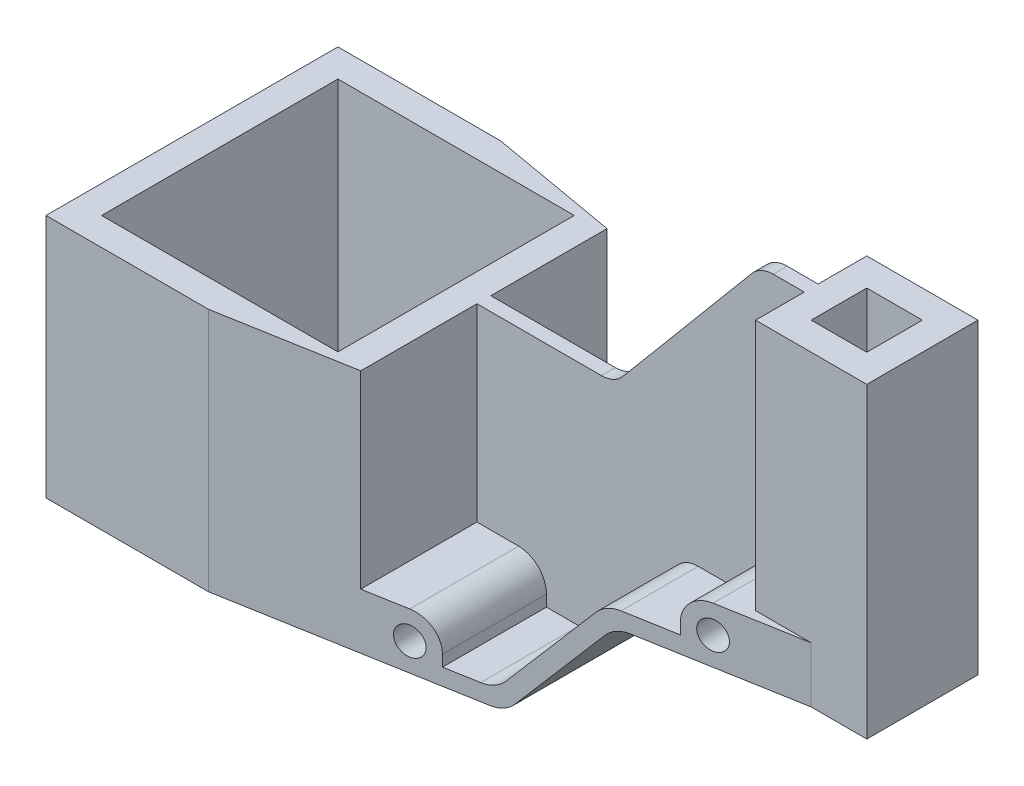
from build123d import *

# Parameters (mm, degrees)
ESQUISSE1_W                   = 105
ESQUISSE1_H                   = 105
ESQUISSE1_W_2                 = 85
ESQUISSE1_H_2                 = 85
BOSS_EXTRU_3_DEPTH            = 88
BOSS_EXTRU_4_DEPTH            = 105
ESQUISSE7_W                   = 40
ESQUISSE7_H                   = 40
ESQUISSE7_W_2                 = 20
ESQUISSE7_H_2                 = 20
BOSS_EXTRU_11_DEPTH           = 110.5
ENL_V_MAT_EXTRU_9_REACH       = 242.562
ESQUISSE13_W                  = 10
ESQUISSE13_H                  = 20
BOSS_EXTRU_12_DEPTH           = 2.5
ESQUISSE17_R                  = 5
ESQUISSE17_W                  = 40
ESQUISSE17_H                  = 20
BOSS_EXTRU_13_DEPTH           = 52.5
ENL_V_MAT_EXTRU_12_DEPTH      = 265.326910813
ENL_V_MAT_EXTRU_12_DEPTH_BACK = 265.326910813
ESQUISSE18_R                  = 5
ENL_V_MAT_EXTRU_13_REACH      = 236.819
ESQUISSE19_W                  = 10
ESQUISSE19_H                  = 20
CONG_1_R                      = 10
ENL_V_MAT_EXTRU_15_DEPTH      = 88


with BuildPart() as part:
    # Esquisse1 → Boss.-Extru.3 (new body)
    with BuildSketch(Plane(origin=(0, 0, 0), x_dir=(1, 0, 0), z_dir=(0, 1, 0))):
        Rectangle(ESQUISSE1_W, ESQUISSE1_H)
        Rectangle(ESQUISSE1_W_2, ESQUISSE1_H_2, mode=Mode.SUBTRACT)
    extrude(amount=BOSS_EXTRU_3_DEPTH)

    # Esquisse3 → Boss.-Extru.4 (add)
    with BuildSketch(Plane.XY.offset(52.5)):
        Polygon((52.5, 6), (52.5, 0), (96.658434537, 0), (130.222419784, 40), (190.222419784, 40), (190.222419784, 46), (127.424573836, 46), (93.860588588, 6), align=None)
    extrude(amount=-BOSS_EXTRU_4_DEPTH)

    # Esquisse7 → Boss.-Extru.11 (add)
    with BuildSketch(Plane.XZ.offset(-40)):
        with Locations((190.222419784, 0)):
            Rectangle(ESQUISSE7_W, ESQUISSE7_H)
        with Locations((190.222419784, 0)):
            Rectangle(ESQUISSE7_W_2, ESQUISSE7_H_2, mode=Mode.SUBTRACT)
    extrude(amount=-BOSS_EXTRU_11_DEPTH)

    # Esquisse13 → Enlèv. mat.-Extru.9 (cut, up to next)
    with BuildSketch(Plane(origin=(0, 46, 0), x_dir=(1, 0, 0), z_dir=(0, 1, 0)), mode=Mode.PRIVATE) as enl_v_mat_extru_9_sk1:
        with Locations((185.222419784, 0)):
            Rectangle(ESQUISSE13_W, ESQUISSE13_H)
    enl_v_mat_extru_9_tool1 = extrude(enl_v_mat_extru_9_sk1.sketch, amount=-ENL_V_MAT_EXTRU_9_REACH, mode=Mode.PRIVATE) & part.part
    add(enl_v_mat_extru_9_tool1.solids().sort_by_distance((185.22242, 46, 0))[0], mode=Mode.SUBTRACT)

    # Esquisse14 → Boss.-Extru.12 (add, symmetric)
    with BuildSketch(Plane.XY):
        Polygon((52.5, 88), (101.965319391, 88), (154.40904634, 150.5), (170.222419784, 150.5), (170.222419784, 46), (127.424573836, 46), (93.860588588, 6), (52.5, 6), align=None)
    extrude(amount=BOSS_EXTRU_12_DEPTH, both=True)

    # Esquisse17 → Boss.-Extru.13 (add, symmetric)
    # profile 1 of 2: a face of its own
    with BuildSketch(Plane.XY):
        Polygon((44, 20), (44, 0), (77.5, 0), (77.5, 6), (77.5, 20), align=None)
        with Locations((67.5, 10)):
            Circle(ESQUISSE17_R, mode=Mode.SUBTRACT)
    # profile 2 of 2: a face of its own
    with BuildSketch(Plane.XY):
        with Locations((170.222419784, 50)):
            Rectangle(ESQUISSE17_W, ESQUISSE17_H)
        with Locations((160.222419784, 50)):
            Circle(ESQUISSE17_R, mode=Mode.SUBTRACT)
    extrude(amount=BOSS_EXTRU_13_DEPTH, both=True)

    # Esquisse18 → Enlèv. mat.-Extru.12 (cut, two sides: drawn at the far end of the back side and taken through both)
    with BuildSketch(Plane.XY.offset(2.5).offset(-ENL_V_MAT_EXTRU_12_DEPTH_BACK)):
        with Locations((160.222419784, 50)):
            Circle(ESQUISSE18_R)
        with Locations((67.5, 10)):
            Circle(ESQUISSE18_R)
    extrude(amount=ENL_V_MAT_EXTRU_12_DEPTH + ENL_V_MAT_EXTRU_12_DEPTH_BACK, mode=Mode.SUBTRACT)

    # Esquisse19 → Enlèv. mat.-Extru.13 (cut, up to next)
    with BuildSketch(Plane(origin=(0, 60, 0), x_dir=(1, 0, 0), z_dir=(0, 1, 0)), mode=Mode.PRIVATE) as enl_v_mat_extru_13_sk1:
        with Locations((185.222419784, 0)):
            Rectangle(ESQUISSE19_W, ESQUISSE19_H)
    enl_v_mat_extru_13_tool1 = extrude(enl_v_mat_extru_13_sk1.sketch, amount=-ENL_V_MAT_EXTRU_13_REACH, mode=Mode.PRIVATE) & part.part
    add(enl_v_mat_extru_13_tool1.solids().sort_by_distance((185.22242, 60, 0))[0], mode=Mode.SUBTRACT)

    # Congé1
    cong_1_edges = [part.edges().sort_by_distance(p)[0] for p in [
        (93.860588588, 6, 27.5),
        (127.424573836, 46, 27.5),
        (154.40904634, 150.5, 0),
        (101.965319391, 88, 0),
        (77.5, 20, 27.5),
        (77.5, 20, -27.5),
        (150.222419784, 60, 27.5),
        (150.222419784, 60, -27.5),
        (127.424573836, 46, -27.5),
        (93.860588588, 6, -27.5),
        (96.658434537, 0, 0),
        (130.222419784, 40, 0),
    ]]
    fillet(cong_1_edges, radius=CONG_1_R)

    # Esquisse20 → Enlèv. mat.-Extru.15 (cut)
    with BuildSketch(Plane(origin=(0, 0, 0), x_dir=(1, 0, 0), z_dir=(0, 1, 0))):
        Polygon((6, 52.5), (190.222419784, 20), (210.222419784, 20), (210.222419784, 52.5), align=None)
        Polygon((210.222419784, -20), (190.222419784, -20), (6, -52.5), (210.222419784, -52.5), align=None)
    extrude(amount=ENL_V_MAT_EXTRU_15_DEPTH, mode=Mode.SUBTRACT)


solid = part.part
